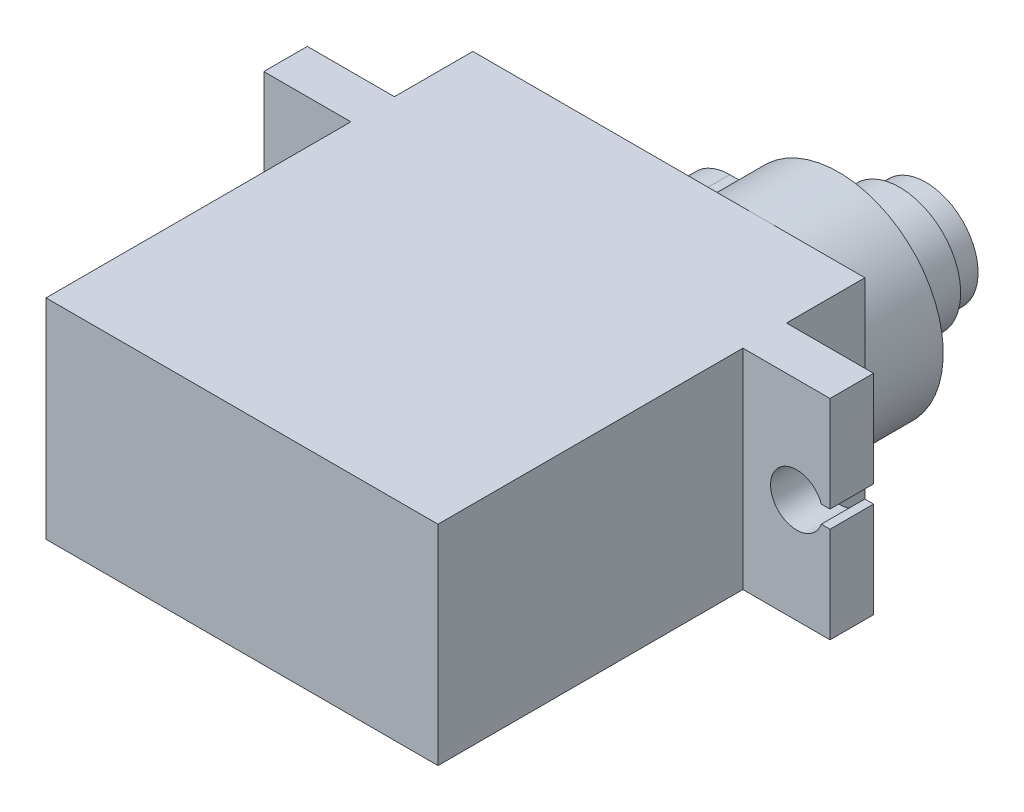
from build123d import *

# Parameters (mm, degrees)
BOSS_EXTRUDE1_DEPTH = 2.5
SKETCH3_W           = 22.5
SKETCH3_H           = 12
BOSS_EXTRUDE2_DEPTH = 17.5
SKETCH4_W           = 22.5
SKETCH4_H           = 12
BOSS_EXTRUDE3_DEPTH = 4.5
BOSS_EXTRUDE4_DEPTH = 4.5
SKETCH6_R           = 3.5
BOSS_EXTRUDE5_DEPTH = 5
CUT_EXTRUDE1_START  = -1.5
SKETCH7_R           = 3.5
SKETCH7_R_2         = 3
CUT_EXTRUDE1_DEPTH  = 1.5


with BuildPart() as part:
    # Sketch2 → Boss-Extrude1 (new body)
    with BuildSketch(Plane.XY):
        with BuildLine():
            Line((-16.25, -6), (0, -6))
            Line((0, -6), (16.25, -6))
            Line((16.25, -6), (16.25, -0.5))
            Line((16.25, -0.5), (15.75, -0.5))
            ThreePointArc((15.75, -0.5), (12.835786438, 0), (15.75, 0.5))
            Line((15.75, 0.5), (16.25, 0.5))
            Line((16.25, 0.5), (16.25, 6))
            Line((16.25, 6), (0, 6))
            Line((0, 6), (-16.25, 6))
            Line((-16.25, 6), (-16.25, 0.5))
            Line((-16.25, 0.5), (-15.75, 0.5))
            ThreePointArc((-15.75, 0.5), (-12.835786438, 0), (-15.75, -0.5))
            Line((-15.75, -0.5), (-16.25, -0.5))
            Line((-16.25, -0.5), (-16.25, -6))
        make_face()
    extrude(amount=BOSS_EXTRUDE1_DEPTH)

    # Sketch3 → Boss-Extrude2 (add)
    with BuildSketch(Plane.XY.offset(2.5)):
        Rectangle(SKETCH3_W, SKETCH3_H)
    extrude(amount=BOSS_EXTRUDE2_DEPTH)

    # Sketch4 → Boss-Extrude3 (add)
    with BuildSketch(Plane(origin=(0, 0, 0), x_dir=(-1, 0, 0), z_dir=(0, 0, -1))):
        Rectangle(SKETCH4_W, SKETCH4_H)
    extrude(amount=BOSS_EXTRUDE3_DEPTH)

    # Sketch5 → Boss-Extrude4 (add)
    with BuildSketch(Plane(origin=(0, 0, -4.5), x_dir=(-1, 0, 0), z_dir=(0, 0, -1))):
        with BuildLine():
            Line((1, 2.75), (0.082682252, 2.75))
            ThreePointArc((0.082682252, 2.75), (-11.25, 0), (0.082682252, -2.75))
            Line((0.082682252, -2.75), (1, -2.75))
            ThreePointArc((1, -2.75), (3.75, 0), (1, 2.75))
        make_face()
    extrude(amount=BOSS_EXTRUDE4_DEPTH)

    # Sketch6 → Boss-Extrude5 (add)
    with BuildSketch(Plane(origin=(0, 0, -9), x_dir=(-1, 0, 0), z_dir=(0, 0, -1))):
        with Locations((-5.25, 0)):
            Circle(SKETCH6_R)
    extrude(amount=BOSS_EXTRUDE5_DEPTH)

    # Sketch7 → Cut-Extrude1 (cut)
    with BuildSketch(Plane(origin=(0, 0, -14), x_dir=(-1, 0, 0), z_dir=(0, 0, -1)).offset(CUT_EXTRUDE1_START)):
        with Locations((-5.25, 0)):
            Circle(SKETCH7_R)
        with Locations((-5.25, 0)):
            Circle(SKETCH7_R_2, mode=Mode.SUBTRACT)
    extrude(amount=CUT_EXTRUDE1_DEPTH, mode=Mode.SUBTRACT)


solid = part.part
